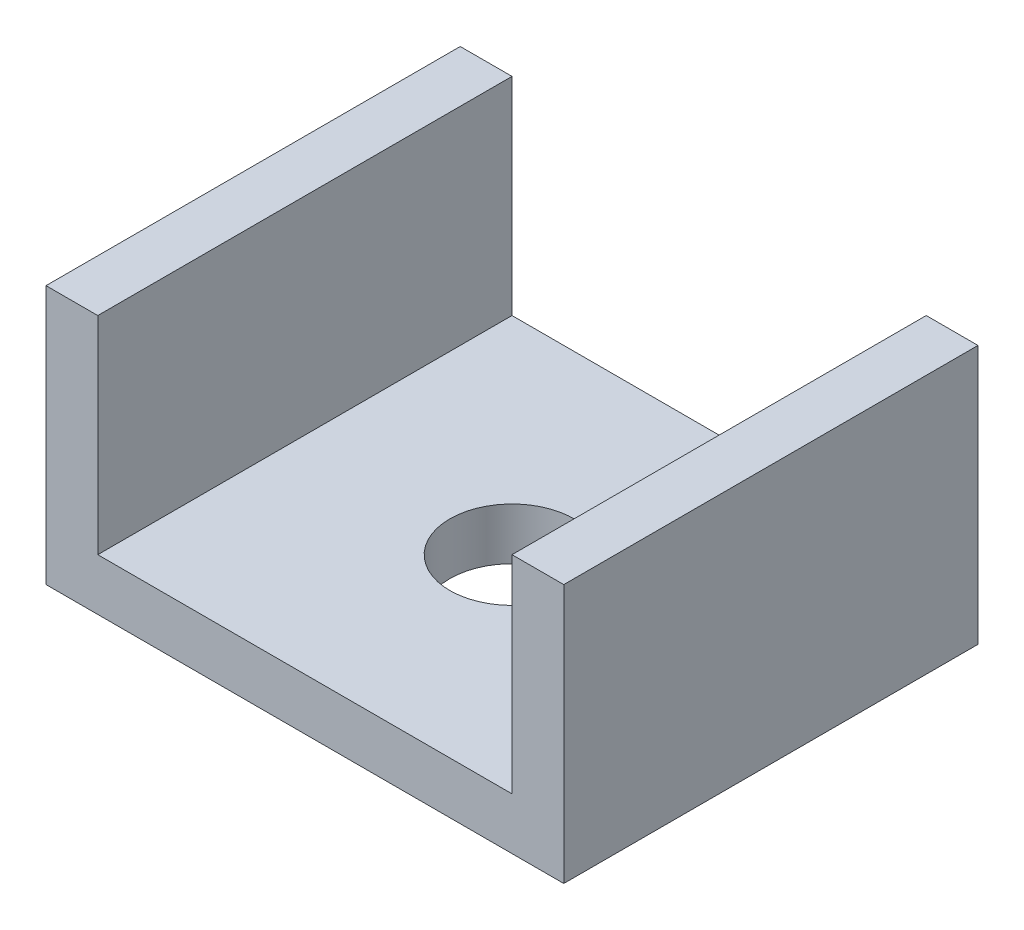
from build123d import *

# Parameters (mm, degrees)
BOSS_EXTRUDE1_DEPTH = 25.4
SKETCH3_R           = 3.81
CUT_EXTRUDE1_DEPTH  = 33.534068682


with BuildPart() as part:
    # Sketch2 → Boss-Extrude1 (new body)
    with BuildSketch(Plane.XY):
        Polygon((15.875, 0), (-15.875, 0), (-15.875, 15.875), (-12.7, 15.875), (-12.7, 3.175), (12.7, 3.175), (12.7, 15.875), (15.875, 15.875), align=None)
    extrude(amount=BOSS_EXTRUDE1_DEPTH)

    # Sketch3 → Cut-Extrude1 (cut, through all)
    with BuildSketch(Plane(origin=(0, 3.175, 0), x_dir=(1, 0, 0), z_dir=(0, 1, 0))):
        with Locations(Location((0, -12.7, 0), (0, 0, 180))):
            Circle(SKETCH3_R)
    extrude(amount=-CUT_EXTRUDE1_DEPTH, mode=Mode.SUBTRACT)


solid = part.part
